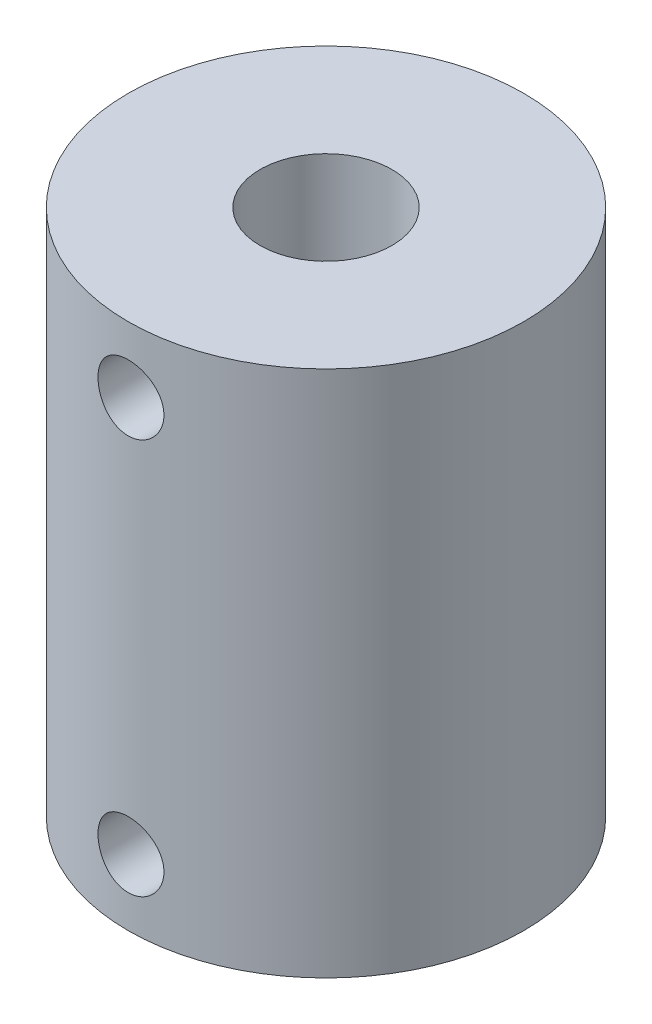
from build123d import *

# Parameters (mm, degrees)
SKETCH1_R           = 9.525
BOSS_EXTRUDE1_DEPTH = 25.4
SKETCH2_R           = 3.175
CUT_EXTRUDE1_DEPTH  = 12.7
SKETCH4_R           = 1.5875
CUT_EXTRUDE2_DEPTH  = 29.750847814
SKETCH5_R           = 3.01625
CUT_EXTRUDE3_DEPTH  = 19.513272438


with BuildPart() as part:
    # Sketch1 → Boss-Extrude1 (new body)
    with BuildSketch(Plane(origin=(0, 0, 0), x_dir=(1, 0, 0), z_dir=(0, 1, 0))):
        with Locations(Location((0, 0, 0), (0, 0, 270))):
            Circle(SKETCH1_R)
    extrude(amount=BOSS_EXTRUDE1_DEPTH)

    # Sketch2 → Cut-Extrude1 (cut)
    with BuildSketch(Plane(origin=(0, 25.4, 0), x_dir=(1, 0, 0), z_dir=(0, 1, 0))):
        with Locations(Location((0, 0, 0), (0, 0, 270))):
            Circle(SKETCH2_R)
    extrude(amount=-CUT_EXTRUDE1_DEPTH, mode=Mode.SUBTRACT)

    # Sketch4 → Cut-Extrude2 (cut, through all)
    with BuildSketch(Plane.XY):
        with Locations(Location((0, 22.225, 0), (0, 0, 270))):
            Circle(SKETCH4_R)
        with Locations(Location((0, 3.175, 0), (0, 0, 90))):
            Circle(SKETCH4_R)
    extrude(amount=CUT_EXTRUDE2_DEPTH, mode=Mode.SUBTRACT)

    # Sketch5 → Cut-Extrude3 (cut, through all)
    with BuildSketch(Plane(origin=(0, 12.7, 0), x_dir=(1, 0, 0), z_dir=(0, 1, 0))):
        with Locations(Location((0, 0, 0), (0, 0, 270))):
            Circle(SKETCH5_R)
    extrude(amount=-CUT_EXTRUDE3_DEPTH, mode=Mode.SUBTRACT)


solid = part.part
